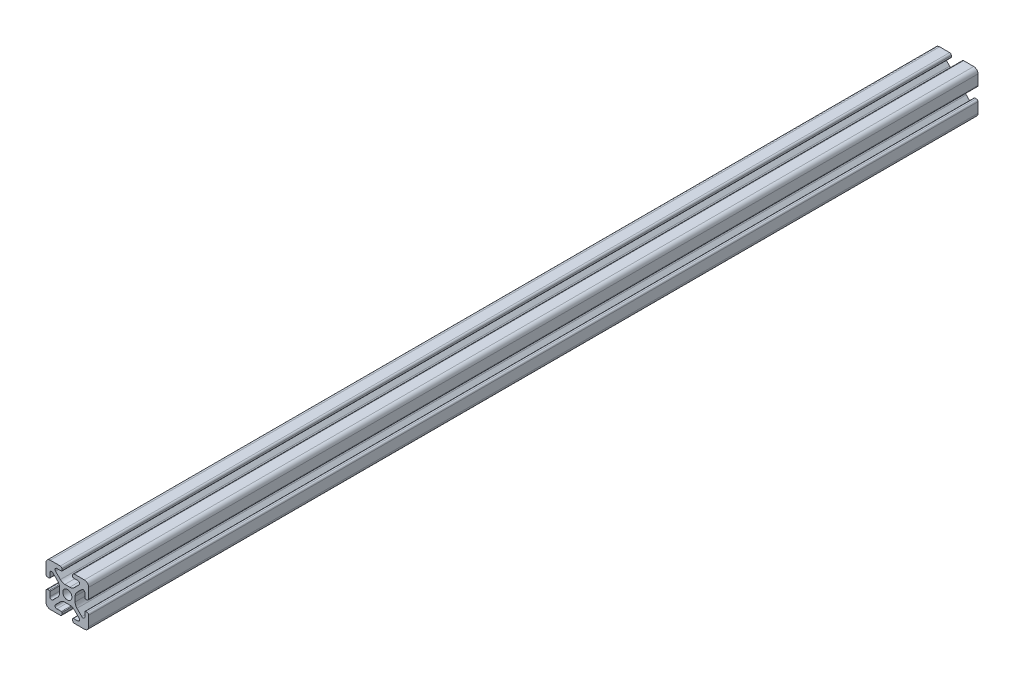
from build123d import *

# Parameters (mm, degrees)
SKETCH1_R           = 2.1463
BOSS_EXTRUDE1_DEPTH = 208.1911


with BuildPart() as part:
    # Sketch1 → Boss-Extrude1 (new, symmetric)
    with BuildSketch(Plane.XY):
        with BuildLine():
            Line((-9.9949, 7.9883), (-9.9949, 3.2893))
            ThreePointArc((-9.9949, 3.2893), (-9.76427588, 2.73252412), (-9.2075, 2.5019))
            Line((-9.2075, 2.5019), (-8.4963, 2.5019))
            ThreePointArc((-8.4963, 2.5019), (-8.280773853, 2.591173853), (-8.1915, 2.8067))
            Line((-8.1915, 2.8067), (-8.1915, 4.9149))
            ThreePointArc((-8.1915, 4.9149), (-7.674065253, 5.689295824), (-6.760603096, 5.507596904))
            Line((-6.760603096, 5.507596904), (-4.505765747, 3.252759555))
            ThreePointArc((-4.505765747, 3.252759555), (-3.856054457, 2.280397894), (-3.627906192, 1.133419111))
            Line((-3.627906192, 1.133419111), (-3.627906192, -1.133419111))
            ThreePointArc((-3.627906192, -1.133419111), (-3.856054457, -2.280397894), (-4.505765747, -3.252759555))
            Line((-4.505765747, -3.252759555), (-6.760603096, -5.507596904))
            ThreePointArc((-6.760603096, -5.507596904), (-7.674065253, -5.689295824), (-8.1915, -4.9149))
            Line((-8.1915, -4.9149), (-8.1915, -2.8067))
            ThreePointArc((-8.1915, -2.8067), (-8.280773853, -2.591173853), (-8.4963, -2.5019))
            Line((-8.4963, -2.5019), (-9.2075, -2.5019))
            ThreePointArc((-9.2075, -2.5019), (-9.76427588, -2.73252412), (-9.9949, -3.2893))
            Line((-9.9949, -3.2893), (-9.9949, -7.9883))
            ThreePointArc((-9.9949, -7.9883), (-9.407180467, -9.407180467), (-7.9883, -9.9949))
            Line((-7.9883, -9.9949), (-3.2893, -9.9949))
            ThreePointArc((-3.2893, -9.9949), (-2.73252412, -9.76427588), (-2.5019, -9.2075))
            Line((-2.5019, -9.2075), (-2.5019, -8.4963))
            ThreePointArc((-2.5019, -8.4963), (-2.591173853, -8.280773853), (-2.8067, -8.1915))
            Line((-2.8067, -8.1915), (-4.9149, -8.1915))
            ThreePointArc((-4.9149, -8.1915), (-5.689295824, -7.674065253), (-5.507596904, -6.760603096))
            Line((-5.507596904, -6.760603096), (-3.252759555, -4.505765747))
            ThreePointArc((-3.252759555, -4.505765747), (-2.280397894, -3.856054457), (-1.133419111, -3.627906192))
            Line((-1.133419111, -3.627906192), (1.133419111, -3.627906192))
            ThreePointArc((1.133419111, -3.627906192), (2.280397894, -3.856054457), (3.252759555, -4.505765747))
            Line((3.252759555, -4.505765747), (5.507596904, -6.760603096))
            ThreePointArc((5.507596904, -6.760603096), (5.689295824, -7.674065253), (4.9149, -8.1915))
            Line((4.9149, -8.1915), (2.8067, -8.1915))
            ThreePointArc((2.8067, -8.1915), (2.591173853, -8.280773853), (2.5019, -8.4963))
            Line((2.5019, -8.4963), (2.5019, -9.2075))
            ThreePointArc((2.5019, -9.2075), (2.73252412, -9.76427588), (3.2893, -9.9949))
            Line((3.2893, -9.9949), (7.9883, -9.9949))
            ThreePointArc((7.9883, -9.9949), (9.407180467, -9.407180467), (9.9949, -7.9883))
            Line((9.9949, -7.9883), (9.9949, -3.2893))
            ThreePointArc((9.9949, -3.2893), (9.76427588, -2.73252412), (9.2075, -2.5019))
            Line((9.2075, -2.5019), (8.4963, -2.5019))
            ThreePointArc((8.4963, -2.5019), (8.280773853, -2.591173853), (8.1915, -2.8067))
            Line((8.1915, -2.8067), (8.1915, -4.9149))
            ThreePointArc((8.1915, -4.9149), (7.674065253, -5.689295824), (6.760603096, -5.507596904))
            Line((6.760603096, -5.507596904), (4.505765747, -3.252759555))
            ThreePointArc((4.505765747, -3.252759555), (3.856054457, -2.280397894), (3.627906192, -1.133419111))
            Line((3.627906192, -1.133419111), (3.627906192, 1.133419111))
            ThreePointArc((3.627906192, 1.133419111), (3.856054457, 2.280397894), (4.505765747, 3.252759555))
            Line((4.505765747, 3.252759555), (6.760603096, 5.507596904))
            ThreePointArc((6.760603096, 5.507596904), (7.674065253, 5.689295824), (8.1915, 4.9149))
            Line((8.1915, 4.9149), (8.1915, 2.8067))
            ThreePointArc((8.1915, 2.8067), (8.280773853, 2.591173853), (8.4963, 2.5019))
            Line((8.4963, 2.5019), (9.2075, 2.5019))
            ThreePointArc((9.2075, 2.5019), (9.76427588, 2.73252412), (9.9949, 3.2893))
            Line((9.9949, 3.2893), (9.9949, 7.9883))
            ThreePointArc((9.9949, 7.9883), (9.407180467, 9.407180467), (7.9883, 9.9949))
            Line((7.9883, 9.9949), (3.2893, 9.9949))
            ThreePointArc((3.2893, 9.9949), (2.73252412, 9.76427588), (2.5019, 9.2075))
            Line((2.5019, 9.2075), (2.5019, 8.4963))
            ThreePointArc((2.5019, 8.4963), (2.591173853, 8.280773853), (2.8067, 8.1915))
            Line((2.8067, 8.1915), (4.9149, 8.1915))
            ThreePointArc((4.9149, 8.1915), (5.689295824, 7.674065253), (5.507596904, 6.760603096))
            Line((5.507596904, 6.760603096), (3.252759555, 4.505765747))
            ThreePointArc((3.252759555, 4.505765747), (2.280397894, 3.856054457), (1.133419111, 3.627906192))
            Line((1.133419111, 3.627906192), (-1.133419111, 3.627906192))
            ThreePointArc((-1.133419111, 3.627906192), (-2.280397894, 3.856054457), (-3.252759555, 4.505765747))
            Line((-3.252759555, 4.505765747), (-5.507596904, 6.760603096))
            ThreePointArc((-5.507596904, 6.760603096), (-5.689295824, 7.674065253), (-4.9149, 8.1915))
            Line((-4.9149, 8.1915), (-2.8067, 8.1915))
            ThreePointArc((-2.8067, 8.1915), (-2.591173853, 8.280773853), (-2.5019, 8.4963))
            Line((-2.5019, 8.4963), (-2.5019, 9.2075))
            ThreePointArc((-2.5019, 9.2075), (-2.73252412, 9.76427588), (-3.2893, 9.9949))
            Line((-3.2893, 9.9949), (-7.9883, 9.9949))
            ThreePointArc((-7.9883, 9.9949), (-9.407180467, 9.407180467), (-9.9949, 7.9883))
        make_face()
        Circle(SKETCH1_R, mode=Mode.SUBTRACT)
    extrude(amount=BOSS_EXTRUDE1_DEPTH, both=True)


solid = part.part
